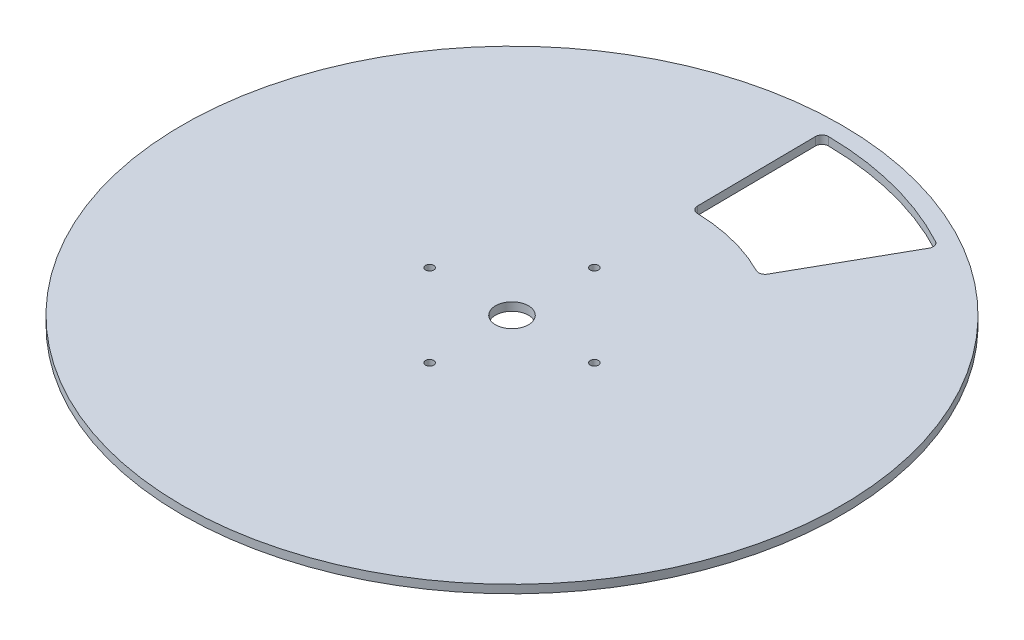
from build123d import *

# Parameters (mm, degrees)
SKETCH1_R           = 127
BOSS_EXTRUDE1_DEPTH = 3.175
SKETCH2_R           = 6.35
CUT_EXTRUDE1_DEPTH  = 180.63318353
CUT_EXTRUDE2_DEPTH  = 180.63318353
SKETCH4_R           = 1.5875
CUT_EXTRUDE3_DEPTH  = 180.63318353
CIRPATTERN1_COUNT   = 4
FILLET1_R           = 2.54


with BuildPart() as part:
    # Sketch1 → Boss-Extrude1 (new body)
    with BuildSketch(Plane(origin=(0, 0, 0), x_dir=(1, 0, 0), z_dir=(0, 1, 0))):
        with Locations(Location((0, 0, 0), (0, 0, 270))):
            Circle(SKETCH1_R)
    extrude(amount=BOSS_EXTRUDE1_DEPTH)

    # Sketch2 → Cut-Extrude1 (cut, through all)
    with BuildSketch(Plane(origin=(0, 3.175, 0), x_dir=(1, 0, 0), z_dir=(0, 1, 0))):
        with Locations(Location((0, 0, 0), (0, 0, 270))):
            Circle(SKETCH2_R)
    extrude(amount=-CUT_EXTRUDE1_DEPTH, mode=Mode.SUBTRACT)

    # Sketch3 → Cut-Extrude2 (cut, through all)
    with BuildSketch(Plane(origin=(0, 3.175, 0), x_dir=(1, 0, 0), z_dir=(0, 1, 0))):
        with BuildLine():
            Line((-0.69608151, 69.707591228), (-1.204718825, 120.643985149))
            ThreePointArc((-1.204718825, 120.643985149), (30.046443244, 116.817986877), (59.221085226, 104.981025331))
            Line((59.221085226, 104.981025331), (34.319233166, 60.837593106))
            ThreePointArc((34.319233166, 60.837593106), (17.387075213, 67.544440681), (-0.69608151, 69.707591228))
        make_face()
    extrude(amount=-CUT_EXTRUDE2_DEPTH, mode=Mode.SUBTRACT)

    # Sketch4 → Cut-Extrude3 (cut, through all)
    with BuildSketch(Plane(origin=(0, 3.175, 0), x_dir=(1, 0, 0), z_dir=(0, 1, 0))):
        with Locations(Location((0, -31.75, 0), (0, 0, 270))):
            Circle(SKETCH4_R)
    cut_extrude3 = extrude(amount=-CUT_EXTRUDE3_DEPTH, mode=Mode.SUBTRACT)

    # CirPattern1: Cut-Extrude3 ×4 about axis
    cirpattern1_axis = Axis((0, 0, 0), (0, 1, 0))
    for i in range(1, CIRPATTERN1_COUNT):
        add(cut_extrude3.rotate(cirpattern1_axis, i * 360 / CIRPATTERN1_COUNT), mode=Mode.SUBTRACT)

    # Fillet1
    fillet1_edges = [part.edges().sort_by_distance(p)[0] for p in [
        (34.319233166, 1.5875, -60.837593106),
        (-0.69608151, 1.5875, -69.707591228),
        (-1.204718825, 1.5875, -120.643985149),
        (59.221085226, 1.5875, -104.981025331),
    ]]
    fillet(fillet1_edges, radius=FILLET1_R)


solid = part.part
